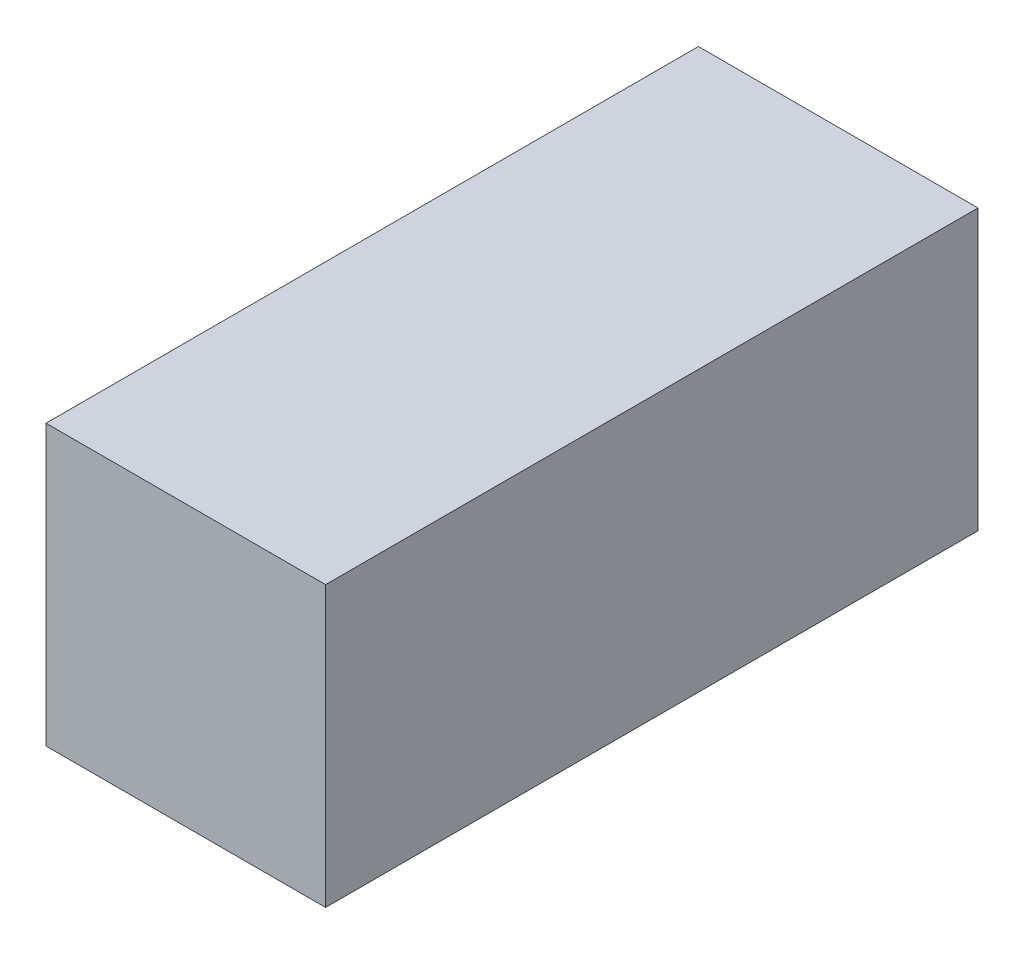
from build123d import *

# Parameters (mm, degrees)
SKETCH1_W           = 30
SKETCH1_H           = 30
BOSS_EXTRUDE1_DEPTH = 70


with BuildPart() as part:
    # Sketch1 → Boss-Extrude1 (new body)
    with BuildSketch(Plane.XY):
        Rectangle(SKETCH1_W, SKETCH1_H)
    extrude(amount=BOSS_EXTRUDE1_DEPTH)


solid = part.part
